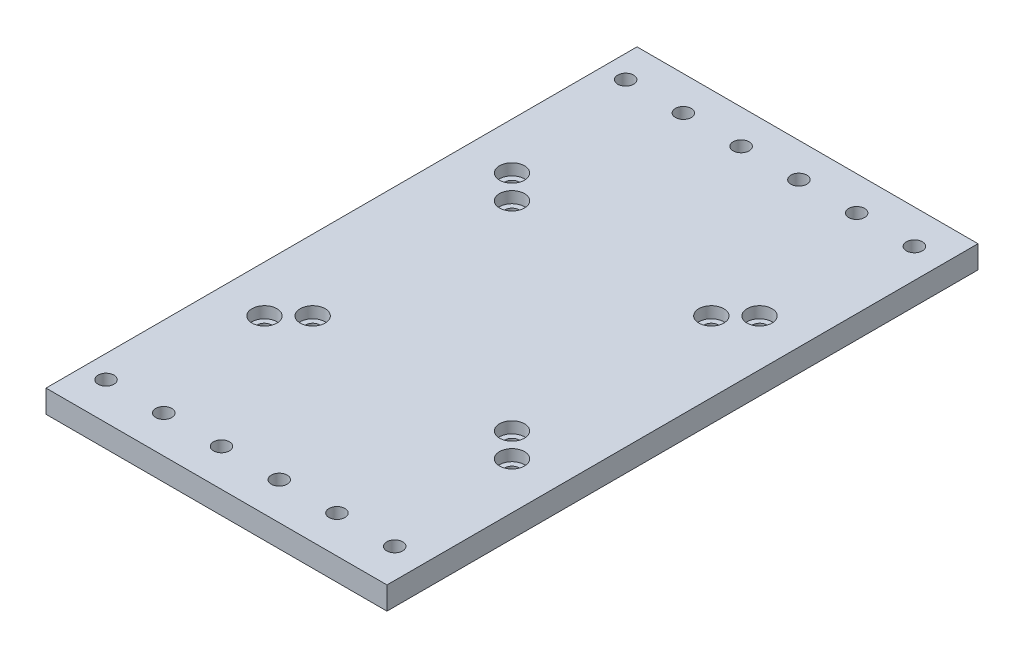
from build123d import *

# Parameters (mm, degrees)
SKETCH2_W           = 150
SKETCH2_H           = 260
BOSS_EXTRUDE1_DEPTH = 10
SKETCH3_R           = 3.125
CUT_EXTRUDE1_DEPTH  = 151.416089565
SKETCH4_R           = 5.5
CUT_EXTRUDE2_DEPTH  = 5
SKETCH5_R           = 3.5
CUT_EXTRUDE3_DEPTH  = 151.416089565


with BuildPart() as part:
    # Sketch2 → Boss-Extrude1 (new body)
    with BuildSketch(Plane(origin=(0, 0, 0), x_dir=(1, 0, 0), z_dir=(0, 1, 0))):
        Rectangle(SKETCH2_W, SKETCH2_H)
    extrude(amount=BOSS_EXTRUDE1_DEPTH)

    # Sketch3 → Cut-Extrude1 (cut, through all)
    with BuildSketch(Plane(origin=(0, 10, 0), x_dir=(1, 0, 0), z_dir=(0, 1, 0))):
        with Locations(Location((-54.447222151, -54.447222151, 0), (0, 0, 270))):
            Circle(SKETCH3_R)
        with Locations(Location((-43.840620434, -43.840620434, 0), (0, 0, 270))):
            Circle(SKETCH3_R)
        with Locations(Location((54.447222151, 54.447222151, 0), (0, 0, 270))):
            Circle(SKETCH3_R)
        with Locations(Location((43.840620434, 43.840620434, 0), (0, 0, 270))):
            Circle(SKETCH3_R)
        with Locations(Location((-54.447222151, 54.447222151, 0), (0, 0, 270))):
            Circle(SKETCH3_R)
        with Locations(Location((-43.840620434, 43.840620434, 0), (0, 0, 270))):
            Circle(SKETCH3_R)
        with Locations(Location((54.447222151, -54.447222151, 0), (0, 0, 270))):
            Circle(SKETCH3_R)
        with Locations(Location((43.840620434, -43.840620434, 0), (0, 0, 270))):
            Circle(SKETCH3_R)
    extrude(amount=-CUT_EXTRUDE1_DEPTH, mode=Mode.SUBTRACT)

    # Sketch4 → Cut-Extrude2 (cut, symmetric)
    with BuildSketch(Plane(origin=(0, 10, 0), x_dir=(1, 0, 0), z_dir=(0, 1, 0))):
        with Locations(Location((-43.840620434, -43.840620434, 0), (0, 0, 270))):
            Circle(SKETCH4_R)
        with Locations(Location((-54.447222151, -54.447222151, 0), (0, 0, 270))):
            Circle(SKETCH4_R)
        with Locations(Location((43.840620434, -43.840620434, 0), (0, 0, 270))):
            Circle(SKETCH4_R)
        with Locations(Location((54.447222151, -54.447222151, 0), (0, 0, 270))):
            Circle(SKETCH4_R)
        with Locations(Location((43.840620434, 43.840620434, 0), (0, 0, 270))):
            Circle(SKETCH4_R)
        with Locations(Location((54.447222151, 54.447222151, 0), (0, 0, 270))):
            Circle(SKETCH4_R)
        with Locations(Location((-43.840620434, 43.840620434, 0), (0, 0, 270))):
            Circle(SKETCH4_R)
        with Locations(Location((-54.447222151, 54.447222151, 0), (0, 0, 270))):
            Circle(SKETCH4_R)
    extrude(amount=CUT_EXTRUDE2_DEPTH, both=True, mode=Mode.SUBTRACT)

    # Sketch5 → Cut-Extrude3 (cut, through all)
    with BuildSketch(Plane(origin=(0, 10, 0), x_dir=(1, 0, 0), z_dir=(0, 1, 0))):
        with Locations(Location((-65, 115, 0), (0, 0, 270))):
            Circle(SKETCH5_R)
        with Locations(Location((-39.6, 115, 0), (0, 0, 270))):
            Circle(SKETCH5_R)
        with Locations(Location((-14.2, 115, 0), (0, 0, 270))):
            Circle(SKETCH5_R)
        with Locations(Location((11.2, 115, 0), (0, 0, 270))):
            Circle(SKETCH5_R)
        with Locations(Location((36.6, 115, 0), (0, 0, 270))):
            Circle(SKETCH5_R)
        with Locations(Location((62, 115, 0), (0, 0, 270))):
            Circle(SKETCH5_R)
        with Locations(Location((-65, -113.6, 0), (0, 0, 270))):
            Circle(SKETCH5_R)
        with Locations(Location((-39.6, -113.6, 0), (0, 0, 270))):
            Circle(SKETCH5_R)
        with Locations(Location((-14.2, -113.6, 0), (0, 0, 270))):
            Circle(SKETCH5_R)
        with Locations(Location((11.2, -113.6, 0), (0, 0, 270))):
            Circle(SKETCH5_R)
        with Locations(Location((36.6, -113.6, 0), (0, 0, 270))):
            Circle(SKETCH5_R)
        with Locations(Location((62, -113.6, 0), (0, 0, 270))):
            Circle(SKETCH5_R)
    extrude(amount=-CUT_EXTRUDE3_DEPTH, mode=Mode.SUBTRACT)


solid = part.part
